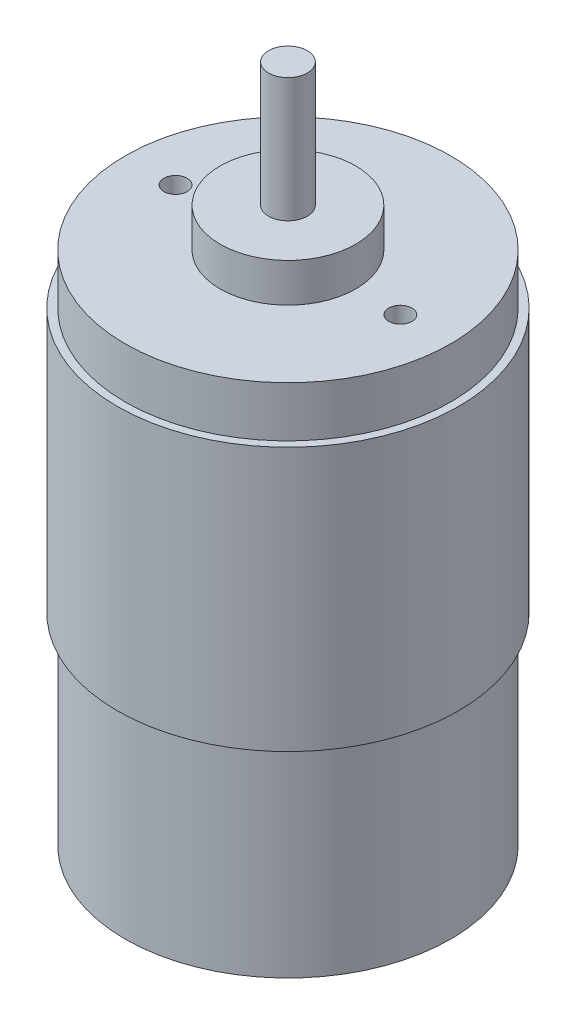
from build123d import *

# Parameters (mm, degrees)
SKETCH_2_R          = 1.5
CUT_EXTRUDE_1_DEPTH = 10


with BuildPart() as part:
    # 草图1 → 旋转1 (revolve)
    with BuildSketch(Plane.XY, mode=Mode.PRIVATE) as revolve_1_sk:
        Polygon((0, 98), (2.5, 98), (2.5, 82), (8.75, 82), (8.75, 77), (21, 77), (21, 70.5), (22, 70.5), (22, 36.5), (21, 36.5), (21, 10.5), (7.5, 10.5), (7.5, 5), (5, 5), (5, 0), (0, 0), align=None)
    revolve(revolve_1_sk.sketch.rotate(Axis((0, 120.576266676, 0), (0, -1, 0)), 90), axis=Axis((0, 120.576266676, 0), (0, -1, 0)))

    # 草图2 → 切除-拉伸1 (cut)
    with BuildSketch(Plane(origin=(0, 77, 0), x_dir=(1, 0, 0), z_dir=(0, 1, 0))):
        with Locations(Location((14.5, 0, 0), (0, 0, 270))):
            Circle(SKETCH_2_R)
        with Locations(Location((-14.5, 0, 0), (0, 0, 90))):
            Circle(SKETCH_2_R)
    extrude(amount=-CUT_EXTRUDE_1_DEPTH, mode=Mode.SUBTRACT)


solid = part.part
